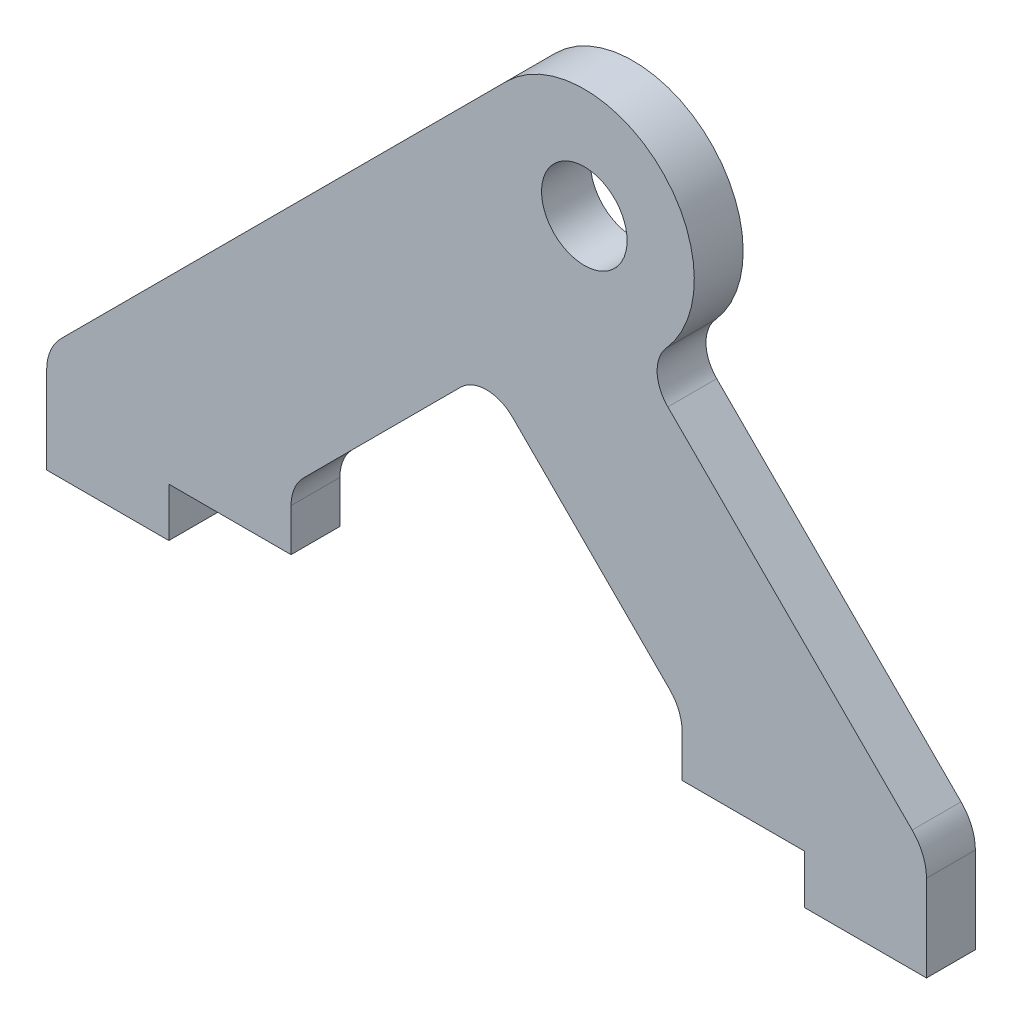
from build123d import *

# Parameters (mm, degrees)
SKETCH1_R           = 1.75
BOSS_EXTRUDE1_DEPTH = 2


with BuildPart() as part:
    # Sketch1 → Boss-Extrude1 (new body)
    with BuildSketch(Plane.XY):
        with BuildLine():
            Line((0, 0), (0, 3.535533906))
            ThreePointArc((0, 3.535533906), (0.152240935, 4.300900771), (0.585786438, 4.949747468))
            Line((0.585786438, 4.949747468), (18.818019485, 23.181980515))
            ThreePointArc((18.818019485, 23.181980515), (25.089650716, 23.271705741), (25.358752948, 17.005208082))
            ThreePointArc((25.358752948, 17.005208082), (24.978951169, 15.964033329), (25.417677093, 14.946283938))
            Line((25.417677093, 14.946283938), (35.414213562, 4.949747468))
            ThreePointArc((35.414213562, 4.949747468), (35.847759065, 4.300900771), (36, 3.535533906))
            Line((36, 3.535533906), (36, 0))
            Line((36, 0), (31, 0))
            Line((31, 0), (31, 2))
            Line((31, 2), (26, 2))
            Line((26, 2), (26, 3.73959236))
            ThreePointArc((26, 3.73959236), (25.866789182, 4.409288367), (25.487436867, 4.977029227))
            Line((25.487436867, 4.977029227), (19.060660172, 11.403805922))
            ThreePointArc((19.060660172, 11.403805922), (18, 11.843145751), (16.939339828, 11.403805922))
            Line((16.939339828, 11.403805922), (10.512563133, 4.977029227))
            ThreePointArc((10.512563133, 4.977029227), (10.133210818, 4.409288367), (10, 3.73959236))
            Line((10, 3.73959236), (10, 2))
            Line((10, 2), (5, 2))
            Line((5, 2), (5, 0))
            Line((5, 0), (0, 0))
        make_face()
        with Locations((22, 20)):
            Circle(SKETCH1_R, mode=Mode.SUBTRACT)
    extrude(amount=BOSS_EXTRUDE1_DEPTH)


solid = part.part
